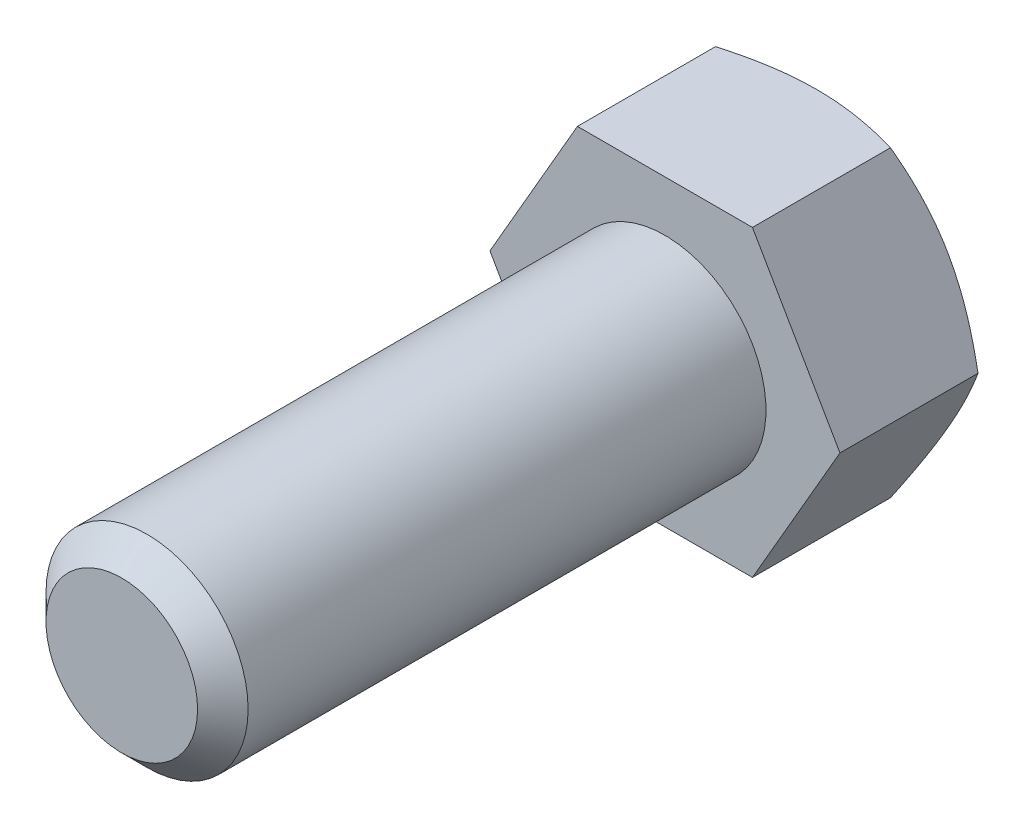
from build123d import *

# Parameters (mm, degrees)
SKETCH_2_R      = 4
EXTRUDE_1_DEPTH = 21.5
EXTRUDE_2_DEPTH = 6
CHAMFER_1_SIZE  = 1


with BuildPart() as part:
    # 草圖2 → 伸長1 (new body)
    with BuildSketch(Plane.XY):
        Circle(SKETCH_2_R)
    extrude(amount=EXTRUDE_1_DEPTH)

    # 草圖3 → 伸長2 (add)
    with BuildSketch(Plane(origin=(0, 0, 0), x_dir=(-1, 0, 0), z_dir=(0, 0, -1))):
        Polygon((3.464101615, -6), (6.92820323, 0), (3.464101615, 6), (-3.464101615, 6), (-6.92820323, 0), (-3.464101615, -6), align=None)
    extrude(amount=EXTRUDE_2_DEPTH)

    # 草圖5 → 除料-旋轉1 (revolve, cut)
    with BuildSketch(Plane(origin=(0, 0, 0), x_dir=(1, 0, 0), z_dir=(0, 1, 0)), mode=Mode.PRIVATE) as cut_revolve_1_sk:
        Polygon((6.92820323, 5.464101615), (6.92820323, 6), (6, 6), align=None)
    revolve(cut_revolve_1_sk.sketch.rotate(Axis((0, 0, 0), (0, 0, -1)), 180), axis=Axis((0, 0, 0), (0, 0, -1)), mode=Mode.SUBTRACT)

    # 導角1
    chamfer_1_edges = [part.edges().sort_by_distance(p)[0] for p in [
        (-4, 0, 21.5),
    ]]
    chamfer(chamfer_1_edges, length=CHAMFER_1_SIZE)


solid = part.part
